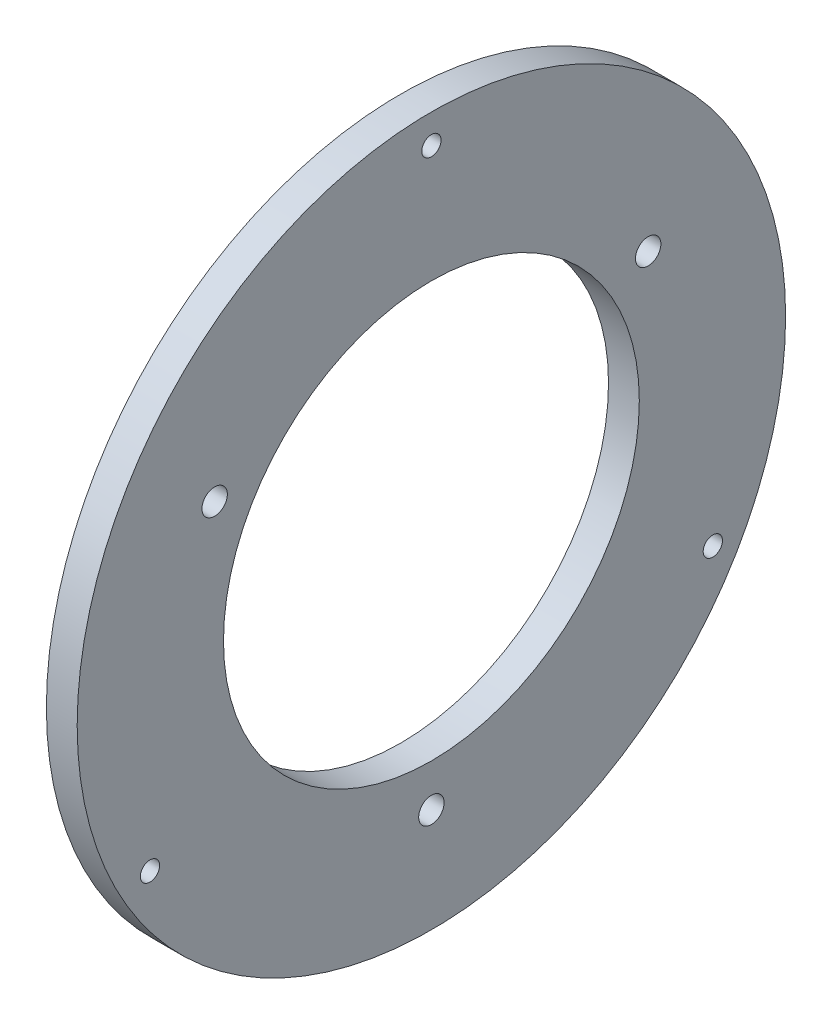
from build123d import *

# Parameters (mm, degrees)
AXIAL_PROFILE_MM_W     = 4
AXIAL_PROFILE_MM_H     = 19
AXIAL_HOLES_DEPTH      = 151.487507787
AXIAL_HOLES_DEPTH_BACK = 151.487507787
SKETCH2_R              = 1.25
SKETCH2_R_2            = 1.65


with BuildPart() as part:
    # Axial profile (mm) → Full revolution (revolve)
    with BuildSketch(Plane.XY, mode=Mode.PRIVATE) as full_revolution_sk:
        with Locations((133.7, 36.5)):
            Rectangle(AXIAL_PROFILE_MM_W, AXIAL_PROFILE_MM_H)
    revolve(full_revolution_sk.sketch.rotate(Axis((-110, 0, 0), (1, 0, 0)), 90), axis=Axis((-110, 0, 0), (1, 0, 0)))

    # Sketch2 → Axial holes (cut, two sides: drawn at the far end of the back side and taken through both)
    with BuildSketch(Plane(origin=(0, 0, 0), x_dir=(0, 0, -1), z_dir=(1, 0, 0)).offset(-AXIAL_HOLES_DEPTH_BACK)):
        with Locations((0, 42.2)):
            Circle(SKETCH2_R)
        with Locations((-36.54627204, -21.1)):
            Circle(SKETCH2_R)
        with Locations((36.54627204, -21.1)):
            Circle(SKETCH2_R)
        with Locations((-28.145825623, 16.25)):
            Circle(SKETCH2_R_2)
        with Locations((0, -32.5)):
            Circle(SKETCH2_R_2)
        with Locations((28.145825623, 16.25)):
            Circle(SKETCH2_R_2)
    extrude(amount=AXIAL_HOLES_DEPTH + AXIAL_HOLES_DEPTH_BACK, mode=Mode.SUBTRACT)


solid = part.part
